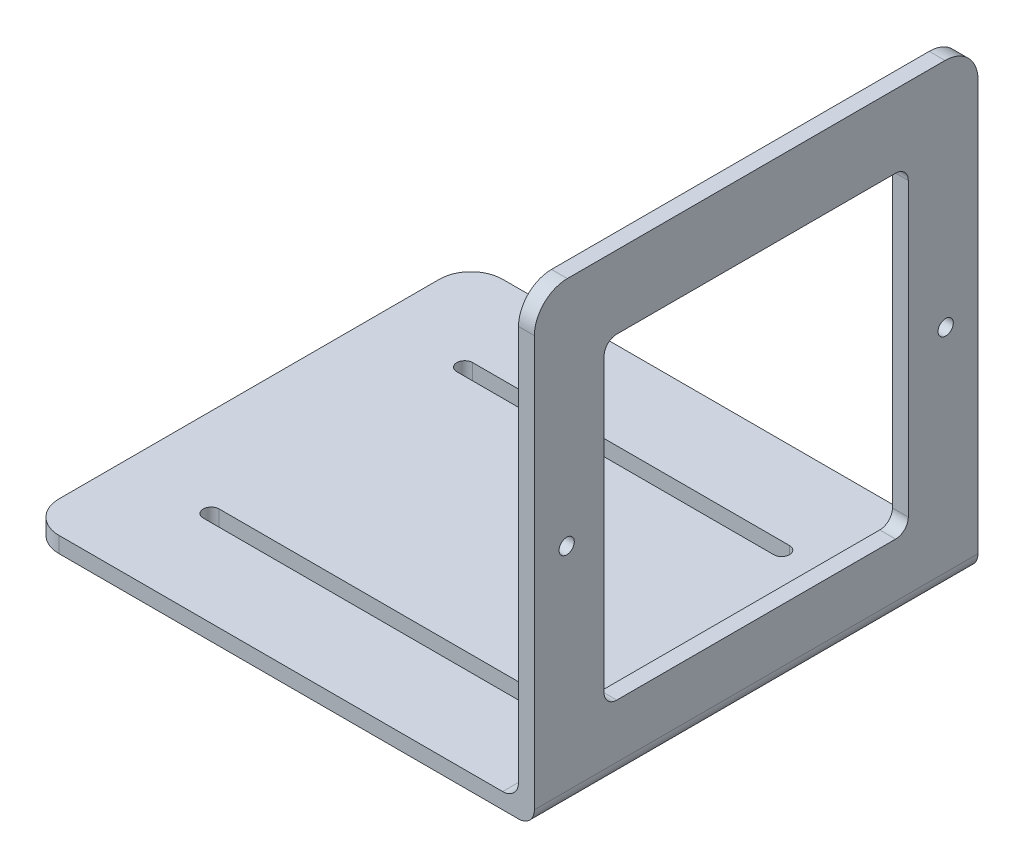
from build123d import *

# Parameters (mm, degrees)
SKETCH2_W           = 101.6
SKETCH2_H           = 88.9
BOSS_EXTRUDE1_DEPTH = 3.175
SKETCH3_W           = 3.175
SKETCH3_H           = 88.9
BOSS_EXTRUDE2_DEPTH = 88.9
SKETCH5_R           = 1.524
SKETCH5_W           = 60.96
SKETCH5_H           = 63.5
CUT_EXTRUDE2_DEPTH  = 145.139405178
FILLET1_R           = 2.54
FILLET2_R           = 6.604
FILLET3_R           = 3.175
FILLET4_R           = 6.35
CUT_EXTRUDE3_DEPTH  = 143.132235964


with BuildPart() as part:
    # Sketch2 → Boss-Extrude1 (new body)
    with BuildSketch(Plane(origin=(0, 0, 0), x_dir=(1, 0, 0), z_dir=(0, 1, 0))):
        with Locations((50.8, 0)):
            Rectangle(SKETCH2_W, SKETCH2_H)
    extrude(amount=BOSS_EXTRUDE1_DEPTH)

    # Sketch3 → Boss-Extrude2 (add)
    with BuildSketch(Plane(origin=(0, 3.175, 0), x_dir=(1, 0, 0), z_dir=(0, 1, 0))):
        with Locations((100.0125, 0)):
            Rectangle(SKETCH3_W, SKETCH3_H)
    extrude(amount=BOSS_EXTRUDE2_DEPTH)

    # Sketch5 → Cut-Extrude2 (cut, through all)
    with BuildSketch(Plane(origin=(101.6, 0, 0), x_dir=(0, 0, -1), z_dir=(1, 0, 0))):
        with Locations((-37.973, 45.72)):
            Circle(SKETCH5_R)
        with Locations((37.973, 45.72)):
            Circle(SKETCH5_R)
        with Locations((0, 45.72)):
            Rectangle(SKETCH5_W, SKETCH5_H)
    extrude(amount=-CUT_EXTRUDE2_DEPTH, mode=Mode.SUBTRACT)

    # Fillet1
    fillet1_edges = [part.edges().sort_by_distance(p)[0] for p in [
        (100.0125, 13.97, 30.48),
        (100.0125, 77.47, 30.48),
        (100.0125, 77.47, -30.48),
        (100.0125, 13.97, -30.48),
    ]]
    fillet(fillet1_edges, radius=FILLET1_R)

    # Fillet2
    fillet2_edges = [part.edges().sort_by_distance(p)[0] for p in [
        (100.0125, 92.075, -44.45),
        (100.0125, 92.075, 44.45),
    ]]
    fillet(fillet2_edges, radius=FILLET2_R)

    # Fillet3
    fillet3_edges = [part.edges().sort_by_distance(p)[0] for p in [
        (98.425, 3.175, 0),
        (101.6, 0, 0),
    ]]
    fillet(fillet3_edges, radius=FILLET3_R)

    # Fillet4
    fillet4_edges = [part.edges().sort_by_distance(p)[0] for p in [
        (0, 1.5875, -44.45),
        (0, 1.5875, 44.45),
    ]]
    fillet(fillet4_edges, radius=FILLET4_R)

    # Sketch6 → Cut-Extrude3 (cut, through all)
    with BuildSketch(Plane(origin=(0, 3.175, 0), x_dir=(1, 0, 0), z_dir=(0, 1, 0))):
        with BuildLine():
            Line((17.795725812, 26.9875), (81.295725812, 26.9875))
            ThreePointArc((81.295725812, 26.9875), (82.883225812, 25.4), (81.295725812, 23.8125))
            Line((81.295725812, 23.8125), (17.795725812, 23.8125))
            ThreePointArc((17.795725812, 23.8125), (16.208225812, 25.4), (17.795725812, 26.9875))
        make_face()
        with BuildLine():
            Line((17.795725812, -26.9875), (81.295725812, -26.9875))
            ThreePointArc((81.295725812, -26.9875), (82.883225812, -25.4), (81.295725812, -23.8125))
            Line((81.295725812, -23.8125), (17.795725812, -23.8125))
            ThreePointArc((17.795725812, -23.8125), (16.208225812, -25.4), (17.795725812, -26.9875))
        make_face()
    extrude(amount=-CUT_EXTRUDE3_DEPTH, mode=Mode.SUBTRACT)


solid = part.part
